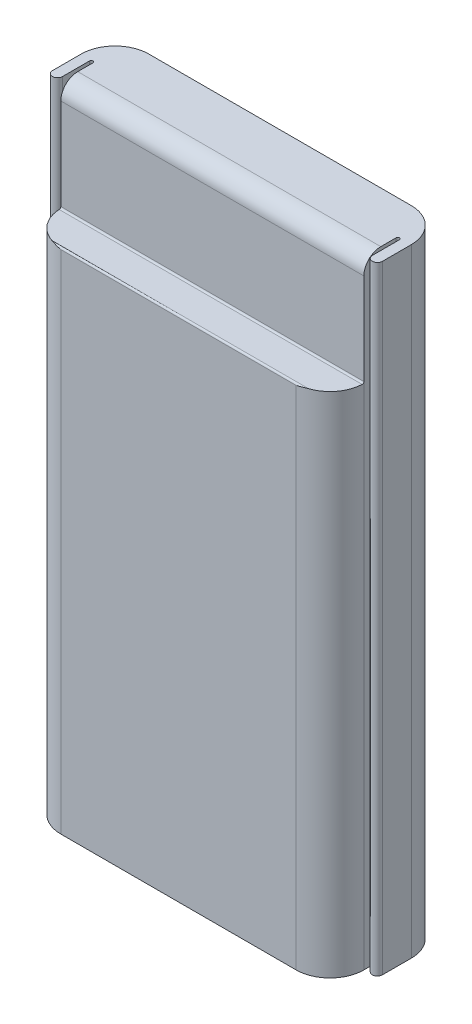
from build123d import *

# Parameters (mm, degrees)
EXTRUDE_1_DEPTH                 = 18.25
CUT_EXTRUDE_1_REACH             = 23.544
CUT_EXTRUDE_1_DIRECTION_2_REACH = 23.544


with BuildPart() as part:
    # Эскиз1 → Бобышка-Вытянуть1 (new, symmetric)
    with BuildSketch(Plane(origin=(0, 0, 0), x_dir=(1, 0, 0), z_dir=(0, 1, 0))):
        with BuildLine():
            Line((-7.75, 0), (7.75, 0))
            ThreePointArc((7.75, 0), (9.164213562, -0.585786438), (9.75, -2))
            Line((9.75, -2), (9.75, -3.7))
            ThreePointArc((9.75, -3.7), (9.45, -4), (9.15, -3.7))
            Line((9.15, -3.7), (9.15, -2.1))
            ThreePointArc((9.15, -2.1), (9.05, -2), (8.95, -2.1))
            Line((8.95, -2.1), (8.95, -4))
            ThreePointArc((8.95, -4), (8.364213562, -5.414213562), (6.95, -6))
            Line((6.95, -6), (-6.95, -6))
            ThreePointArc((-6.95, -6), (-8.364213562, -5.414213562), (-8.95, -4))
            Line((-8.95, -4), (-8.95, -2.1))
            ThreePointArc((-8.95, -2.1), (-9.05, -2), (-9.15, -2.1))
            Line((-9.15, -2.1), (-9.15, -3.7))
            ThreePointArc((-9.15, -3.7), (-9.45, -4), (-9.75, -3.7))
            Line((-9.75, -3.7), (-9.75, -2))
            ThreePointArc((-9.75, -2), (-9.164213562, -0.585786438), (-7.75, 0))
        make_face()
    extrude(amount=EXTRUDE_1_DEPTH, both=True)

    # Эскиз2 → Вырез-Вытянуть1 (cut, up to next)
    with BuildSketch(Plane(origin=(0, 0, 0), x_dir=(0, 0, -1), z_dir=(1, 0, 0)), mode=Mode.PRIVATE) as cut_extrude_1_sk1:
        with BuildLine():
            Line((-4, 17.25), (-4, 11.85))
            ThreePointArc((-4, 11.85), (-4.029289322, 11.779289322), (-4.1, 11.75))
            Line((-4.1, 11.75), (-5.9, 11.75))
            ThreePointArc((-5.9, 11.75), (-5.970710678, 11.720710678), (-6, 11.65))
            Line((-6, 11.65), (-6, 18.25))
            Line((-6, 18.25), (-3, 18.25))
            ThreePointArc((-3, 18.25), (-3.707106781, 17.957106781), (-4, 17.25))
        make_face()
    cut_extrude_1_tool1 = extrude(cut_extrude_1_sk1.sketch, amount=-CUT_EXTRUDE_1_REACH, mode=Mode.PRIVATE) & part.part
    add(cut_extrude_1_tool1.solids().sort_by_distance((0, 15.049144, 4.98045))[0], mode=Mode.SUBTRACT)

    # Эскиз2 → Вырез-Вытянуть1 direction 2 (cut, up to next)
    with BuildSketch(Plane(origin=(0, 0, 0), x_dir=(0, 0, -1), z_dir=(1, 0, 0)), mode=Mode.PRIVATE) as cut_extrude_1_direction_2_sk1:
        with BuildLine():
            Line((-4, 17.25), (-4, 11.85))
            ThreePointArc((-4, 11.85), (-4.029289322, 11.779289322), (-4.1, 11.75))
            Line((-4.1, 11.75), (-5.9, 11.75))
            ThreePointArc((-5.9, 11.75), (-5.970710678, 11.720710678), (-6, 11.65))
            Line((-6, 11.65), (-6, 18.25))
            Line((-6, 18.25), (-3, 18.25))
            ThreePointArc((-3, 18.25), (-3.707106781, 17.957106781), (-4, 17.25))
        make_face()
    cut_extrude_1_direction_2_tool1 = extrude(cut_extrude_1_direction_2_sk1.sketch, amount=CUT_EXTRUDE_1_DIRECTION_2_REACH, mode=Mode.PRIVATE) & part.part
    add(cut_extrude_1_direction_2_tool1.solids().sort_by_distance((0, 15.049144, 4.98045))[0], mode=Mode.SUBTRACT)


solid = part.part
